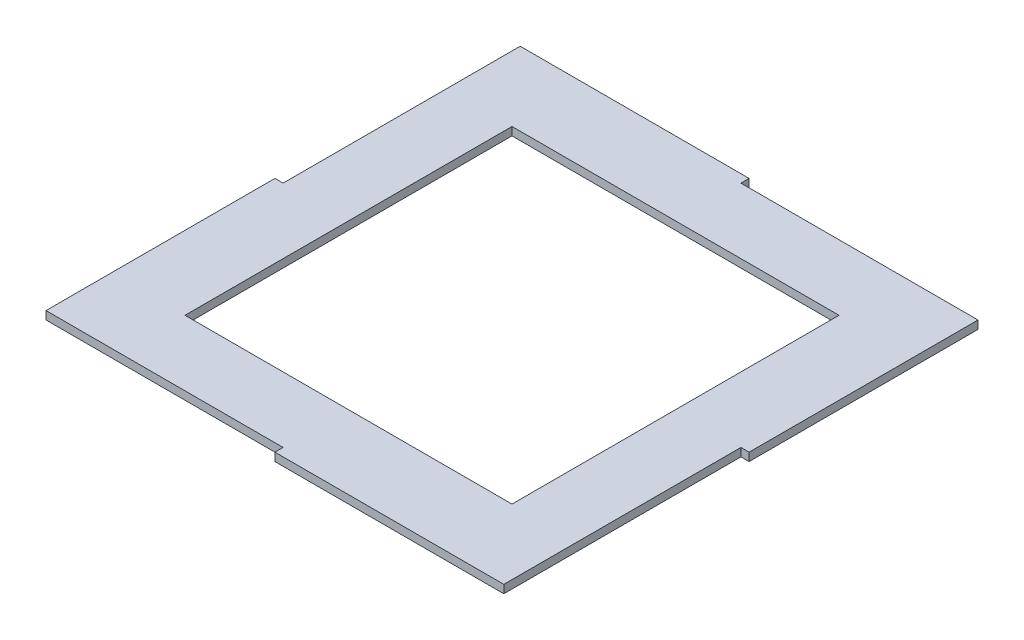
from build123d import *

# Parameters (mm, degrees)
SKETCH1_W           = 127
SKETCH1_H           = 127
BOSS_EXTRUDE1_DEPTH = 3.175


with BuildPart() as part:
    # Sketch1 → Boss-Extrude1 (new body)
    with BuildSketch(Plane(origin=(0, 0, 0), x_dir=(1, 0, 0), z_dir=(0, 1, 0))):
        Polygon((-112.506214689, 96.487711864), (-112.506214689, 4.412711864), (-115.681214689, 4.412711864), (-115.681214689, -84.487288136), (-23.606214689, -84.487288136), (-23.606214689, -87.662288136), (65.293785311, -87.662288136), (65.293785311, 4.412711864), (68.468785311, 4.412711864), (68.468785311, 93.312711864), (-23.606214689, 93.312711864), (-23.606214689, 96.487711864), align=None)
        with Locations((-23.606214689, 4.412711864)):
            Rectangle(SKETCH1_W, SKETCH1_H, mode=Mode.SUBTRACT)
    extrude(amount=BOSS_EXTRUDE1_DEPTH)


solid = part.part
